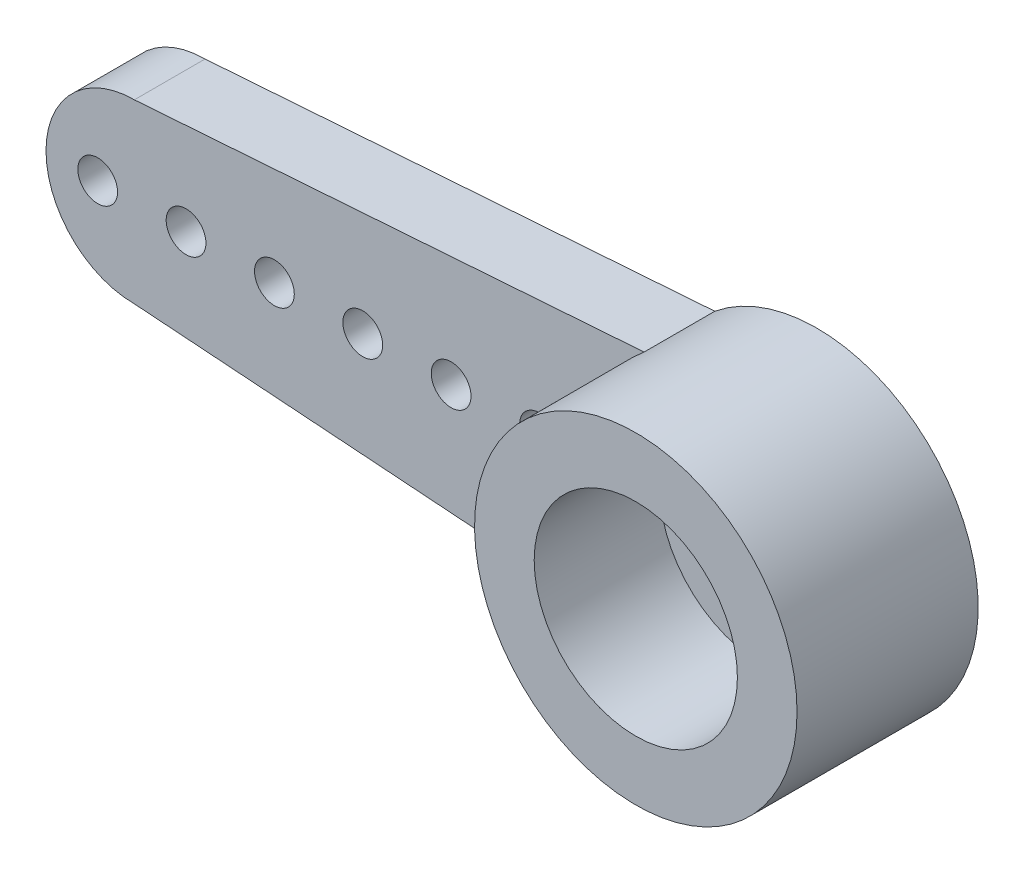
from build123d import *
from build123d.topology import SkipClean

# Parameters (mm, degrees)
RESSALTO_EXTRUS_O1_DEPTH = 1.6
ESBO_O2_R                = 3.65
RESSALTO_EXTRUS_O2_DEPTH = 2.5
ESBO_O3_R                = 2.3
CORTE_EXTRUS_O1_DEPTH    = 2.84
CORTE_EXTRUS_O2_REACH    = 18.456
ESBO_O4_R                = 0.45
ESBO_O5_R                = 1.3
CORTE_EXTRUS_O3_DEPTH    = 2.84
ESBO_O6_R                = 2.45
CORTE_EXTRUS_O4_DEPTH    = 0.78


with BuildPart() as part:
    # Esboço1 → Ressalto-extrusão1 (new body)
    with BuildSketch(Plane.XY):
        with BuildLine():
            Line((-13.85, 2), (-2.311249662, 2.825))
            ThreePointArc((-2.311249662, 2.825), (3.65, 0), (-2.311249662, -2.825))
            Line((-2.311249662, -2.825), (-13.85, -2))
            ThreePointArc((-13.85, -2), (-15.85, 0), (-13.85, 2))
        make_face()
    extrude(amount=RESSALTO_EXTRUS_O1_DEPTH)

    # Esboço2 → Ressalto-extrusão2 (add)
    with SkipClean():  # the faces are left unmerged after this step: merging them gives an invalid solid
        with BuildSketch(Plane.XY.offset(1.6)):
            with Locations(Location((0, 0, 0), (0, 0, 230.711977832))):
                Circle(ESBO_O2_R)
        extrude(amount=RESSALTO_EXTRUS_O2_DEPTH)

    # Esboço3 → Corte-extrusão1 (cut)
    with SkipClean():  # the faces are left unmerged after this step: merging them gives an invalid solid
        with BuildSketch(Plane.XY.offset(4.1)):
            Circle(ESBO_O3_R)
        extrude(amount=-CORTE_EXTRUS_O1_DEPTH, mode=Mode.SUBTRACT)

    # Esboço4 → Corte-extrusão2 (cut, up to next)
    with BuildSketch(Plane.XY.offset(1.6), mode=Mode.PRIVATE) as corte_extrus_o2_sk1:
        with Locations((-4.68, 0)):
            Circle(ESBO_O4_R)
    corte_extrus_o2_tool1 = extrude(corte_extrus_o2_sk1.sketch, amount=-CORTE_EXTRUS_O2_REACH, mode=Mode.PRIVATE) & part.part
    # Esboço4 → Corte-extrusão2 (cut, up to next)
    with BuildSketch(Plane.XY.offset(1.6), mode=Mode.PRIVATE) as corte_extrus_o2_sk2:
        with Locations((-6.68, 0)):
            Circle(ESBO_O4_R)
    corte_extrus_o2_tool2 = extrude(corte_extrus_o2_sk2.sketch, amount=-CORTE_EXTRUS_O2_REACH, mode=Mode.PRIVATE) & part.part
    # Esboço4 → Corte-extrusão2 (cut, up to next)
    with BuildSketch(Plane.XY.offset(1.6), mode=Mode.PRIVATE) as corte_extrus_o2_sk3:
        with Locations((-8.68, 0)):
            Circle(ESBO_O4_R)
    corte_extrus_o2_tool3 = extrude(corte_extrus_o2_sk3.sketch, amount=-CORTE_EXTRUS_O2_REACH, mode=Mode.PRIVATE) & part.part
    # Esboço4 → Corte-extrusão2 (cut, up to next)
    with BuildSketch(Plane.XY.offset(1.6), mode=Mode.PRIVATE) as corte_extrus_o2_sk4:
        with Locations((-10.68, 0)):
            Circle(ESBO_O4_R)
    corte_extrus_o2_tool4 = extrude(corte_extrus_o2_sk4.sketch, amount=-CORTE_EXTRUS_O2_REACH, mode=Mode.PRIVATE) & part.part
    # Esboço4 → Corte-extrusão2 (cut, up to next)
    with BuildSketch(Plane.XY.offset(1.6), mode=Mode.PRIVATE) as corte_extrus_o2_sk5:
        with Locations((-12.68, 0)):
            Circle(ESBO_O4_R)
    corte_extrus_o2_tool5 = extrude(corte_extrus_o2_sk5.sketch, amount=-CORTE_EXTRUS_O2_REACH, mode=Mode.PRIVATE) & part.part
    # Esboço4 → Corte-extrusão2 (cut, up to next)
    with BuildSketch(Plane.XY.offset(1.6), mode=Mode.PRIVATE) as corte_extrus_o2_sk6:
        with Locations((-14.68, 0)):
            Circle(ESBO_O4_R)
    corte_extrus_o2_tool6 = extrude(corte_extrus_o2_sk6.sketch, amount=-CORTE_EXTRUS_O2_REACH, mode=Mode.PRIVATE) & part.part
    add(corte_extrus_o2_tool1.solids().sort_by_distance((-4.68, 0, 1.6))[0], mode=Mode.SUBTRACT)
    add(corte_extrus_o2_tool2.solids().sort_by_distance((-6.68, 0, 1.6))[0], mode=Mode.SUBTRACT)
    add(corte_extrus_o2_tool3.solids().sort_by_distance((-8.68, 0, 1.6))[0], mode=Mode.SUBTRACT)
    add(corte_extrus_o2_tool4.solids().sort_by_distance((-10.68, 0, 1.6))[0], mode=Mode.SUBTRACT)
    add(corte_extrus_o2_tool5.solids().sort_by_distance((-12.68, 0, 1.6))[0], mode=Mode.SUBTRACT)
    add(corte_extrus_o2_tool6.solids().sort_by_distance((-14.68, 0, 1.6))[0], mode=Mode.SUBTRACT)

    # Esboço5 → Corte-extrusão3 (cut)
    with SkipClean():  # the faces are left unmerged after this step: merging them gives an invalid solid
        with BuildSketch(Plane(origin=(0, 0, 0), x_dir=(-1, 0, 0), z_dir=(0, 0, -1))):
            Circle(ESBO_O5_R)
        extrude(amount=-CORTE_EXTRUS_O3_DEPTH, mode=Mode.SUBTRACT)

    # Esboço6 → Corte-extrusão4 (cut)
    with SkipClean():  # the faces are left unmerged after this step: merging them gives an invalid solid
        with BuildSketch(Plane(origin=(0, 0, 0), x_dir=(-1, 0, 0), z_dir=(0, 0, -1))):
            Circle(ESBO_O6_R)
        extrude(amount=-CORTE_EXTRUS_O4_DEPTH, mode=Mode.SUBTRACT)


solid = part.part
